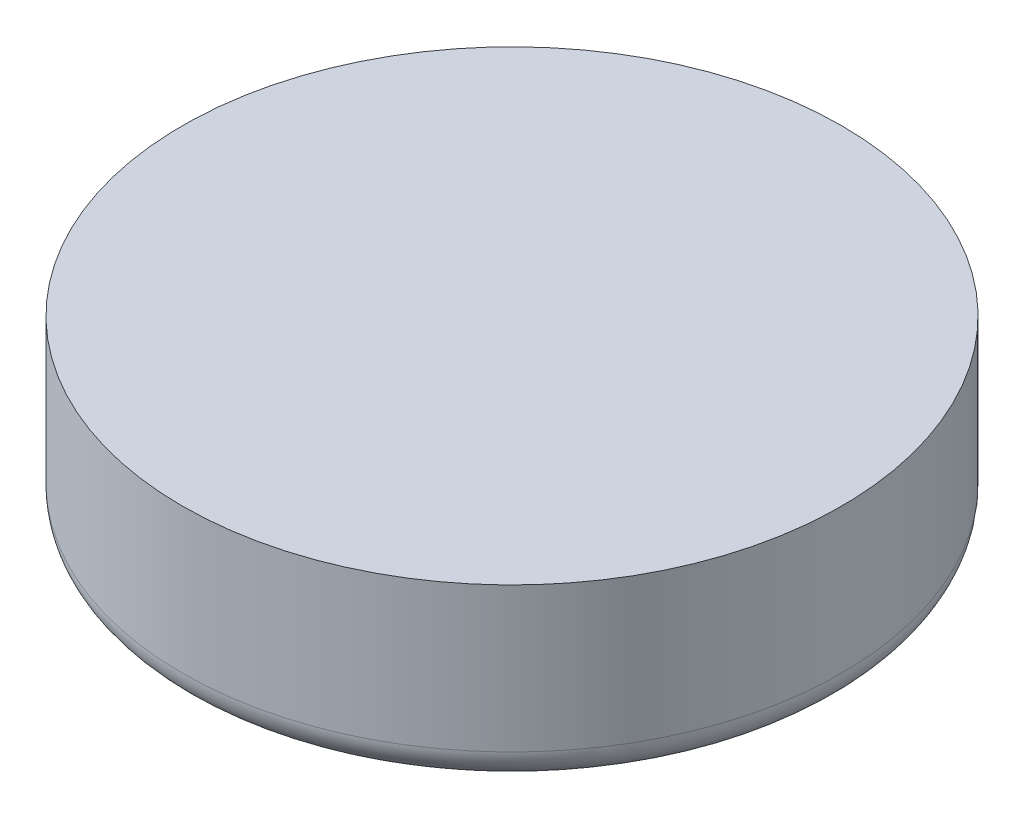
from build123d import *

# Parameters (mm, degrees)
SKETCH_1_R      = 2.05
EXTRUDE_1_DEPTH = 1.1
FILLET_1_R      = 0.2


with BuildPart() as part:
    # 草图1 → 凸台-拉伸1 (new body)
    with BuildSketch(Plane(origin=(0, 0, 0), x_dir=(1, 0, 0), z_dir=(0, 1, 0))):
        with Locations(Location((0, 0, 0), (0, 0, 270))):
            Circle(SKETCH_1_R)
    extrude(amount=EXTRUDE_1_DEPTH)

    # 圆角1
    fillet_1_edges = [part.edges().sort_by_distance(p)[0] for p in [
        (0, 0, -2.05),
    ]]
    fillet(fillet_1_edges, radius=FILLET_1_R)


solid = part.part
